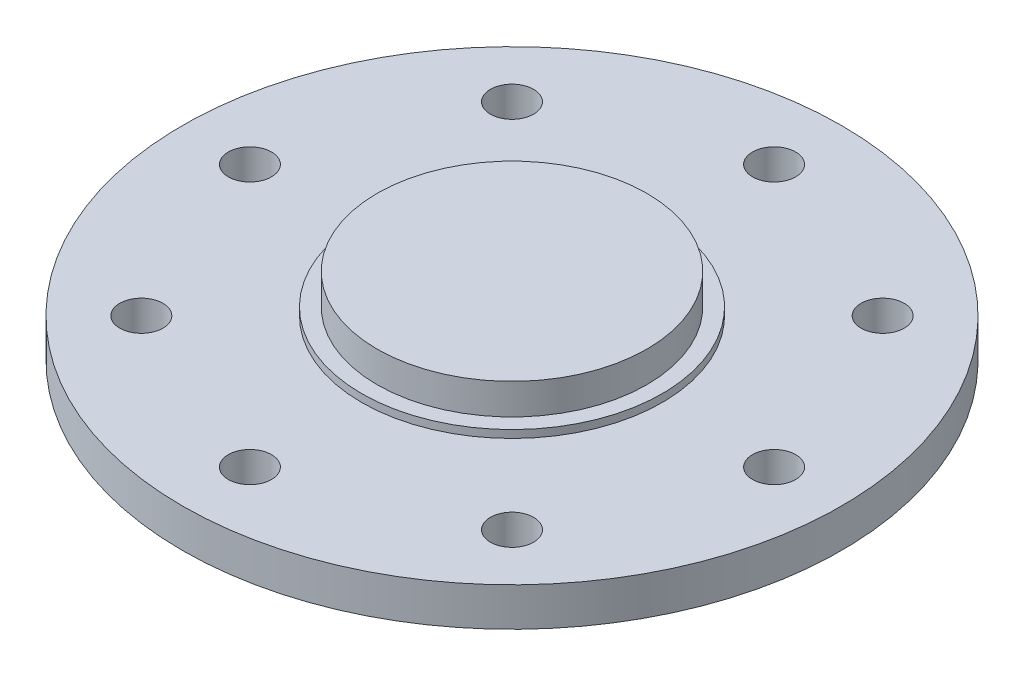
from build123d import *

# Parameters (mm, degrees)
SKETCH1_R           = 42.75
BOSS_EXTRUDE1_DEPTH = 5
SKETCH2_R           = 2.8
CUT_EXTRUDE1_DEPTH  = 61.664033826
SKETCH3_R           = 17.5
BOSS_EXTRUDE2_DEPTH = 5
SKETCH4_R           = 19.5
BOSS_EXTRUDE3_DEPTH = 1


with BuildPart() as part:
    # Sketch1 → Boss-Extrude1 (new body)
    with BuildSketch(Plane(origin=(0, 0, 0), x_dir=(1, 0, 0), z_dir=(0, 1, 0))):
        with Locations(Location((0, 0, 0), (0, 0, 270))):
            Circle(SKETCH1_R)
    extrude(amount=BOSS_EXTRUDE1_DEPTH)

    # Sketch2 → Cut-Extrude1 (cut, through all)
    with BuildSketch(Plane(origin=(0, 5, 0), x_dir=(1, 0, 0), z_dir=(0, 1, 0))):
        with Locations(Location((0, 34, 0), (0, 0, 270))):
            Circle(SKETCH2_R)
        with Locations(Location((24.04163056, 24.04163056, 0), (0, 0, 270))):
            Circle(SKETCH2_R)
        with Locations(Location((34, 0, 0), (0, 0, 270))):
            Circle(SKETCH2_R)
        with Locations(Location((24.04163056, -24.04163056, 0), (0, 0, 270))):
            Circle(SKETCH2_R)
        with Locations(Location((0, -34, 0), (0, 0, 270))):
            Circle(SKETCH2_R)
        with Locations(Location((-24.04163056, -24.04163056, 0), (0, 0, 270))):
            Circle(SKETCH2_R)
        with Locations(Location((-34, 0, 0), (0, 0, 270))):
            Circle(SKETCH2_R)
        with Locations(Location((-24.04163056, 24.04163056, 0), (0, 0, 270))):
            Circle(SKETCH2_R)
    extrude(amount=-CUT_EXTRUDE1_DEPTH, mode=Mode.SUBTRACT)

    # Sketch3 → Boss-Extrude2 (add)
    with BuildSketch(Plane(origin=(0, 5, 0), x_dir=(1, 0, 0), z_dir=(0, 1, 0))):
        with Locations(Location((0, 0, 0), (0, 0, 270))):
            Circle(SKETCH3_R)
    extrude(amount=BOSS_EXTRUDE2_DEPTH)

    # Sketch4 → Boss-Extrude3 (add)
    with BuildSketch(Plane(origin=(0, 5, 0), x_dir=(1, 0, 0), z_dir=(0, 1, 0))):
        with Locations(Location((0, 0, 0), (0, 0, 270))):
            Circle(SKETCH4_R)
    extrude(amount=BOSS_EXTRUDE3_DEPTH)


solid = part.part
